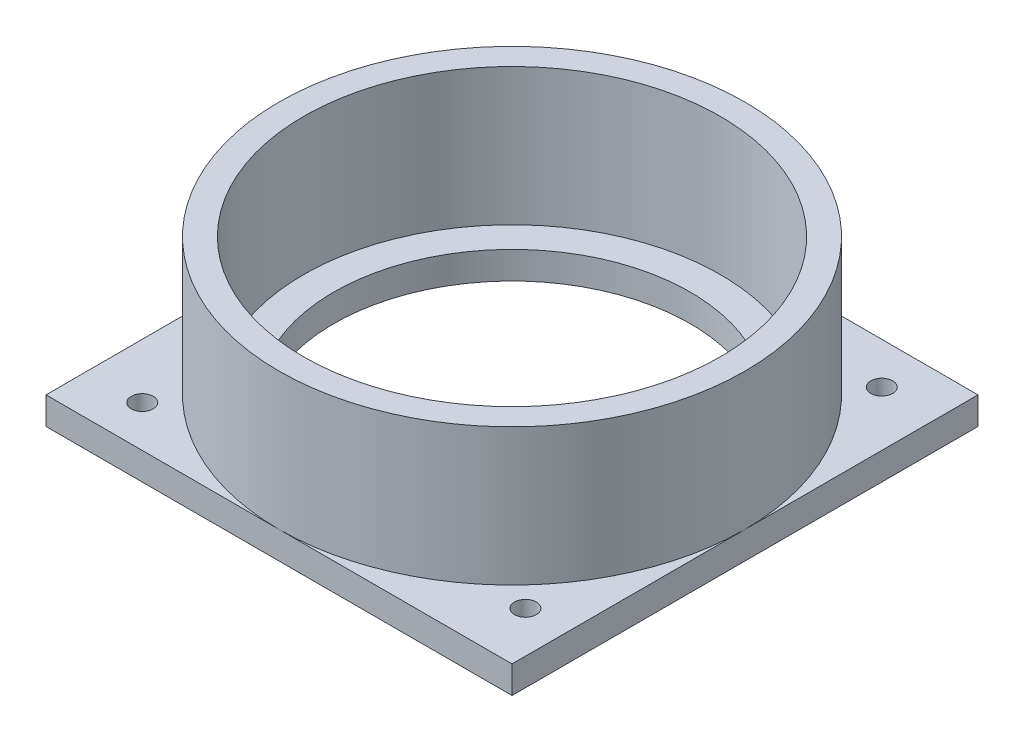
from build123d import *

# Parameters (mm, degrees)
IZIM1_W                     = 85
IZIM1_H                     = 85
Y_KSEKLIK_EKSTR_ZYON1_DEPTH = 5
IZIM2_R                     = 32.5
KES_EKSTR_ZYON1_DEPTH       = 5
IZIM3_R                     = 42.5
IZIM3_R_2                   = 38
Y_KSEKLIK_EKSTR_ZYON2_DEPTH = 25
IZIM4_R                     = 2
KES_EKSTR_ZYON2_DEPTH       = 25


with BuildPart() as part:
    # Çizim1 → Yükseklik-Ekstrüzyon1 (new body)
    with BuildSketch(Plane(origin=(0, 0, 0), x_dir=(1, 0, 0), z_dir=(0, 1, 0))):
        Rectangle(IZIM1_W, IZIM1_H)
    extrude(amount=Y_KSEKLIK_EKSTR_ZYON1_DEPTH)

    # Çizim2 → Kes-Ekstrüzyon1 (cut)
    with BuildSketch(Plane(origin=(0, 5, 0), x_dir=(1, 0, 0), z_dir=(0, 1, 0))):
        with Locations(Location((0, 0, 0), (0, 0, 270))):
            Circle(IZIM2_R)
    extrude(amount=-KES_EKSTR_ZYON1_DEPTH, mode=Mode.SUBTRACT)

    # Çizim3 → Yükseklik-Ekstrüzyon2 (add)
    with BuildSketch(Plane(origin=(0, 5, 0), x_dir=(1, 0, 0), z_dir=(0, 1, 0))):
        with Locations(Location((0, 0, 0), (0, 0, 270))):
            Circle(IZIM3_R)
        with Locations(Location((0, 0, 0), (0, 0, 270))):
            Circle(IZIM3_R_2, mode=Mode.SUBTRACT)
    extrude(amount=Y_KSEKLIK_EKSTR_ZYON2_DEPTH)

    # Çizim4 → Kes-Ekstrüzyon2 (cut)
    with BuildSketch(Plane(origin=(0, 5, 0), x_dir=(1, 0, 0), z_dir=(0, 1, 0))):
        with Locations(Location((-34.943063938, 32.5, 0), (0, 0, 270))):
            Circle(IZIM4_R)
        with Locations(Location((32.5, 34.943063938, 0), (0, 0, 270))):
            Circle(IZIM4_R)
        with Locations(Location((34.943063938, -32.5, 0), (0, 0, 270))):
            Circle(IZIM4_R)
        with Locations(Location((-32.5, -34.943063938, 0), (0, 0, 270))):
            Circle(IZIM4_R)
    extrude(amount=-KES_EKSTR_ZYON2_DEPTH, mode=Mode.SUBTRACT)


solid = part.part
